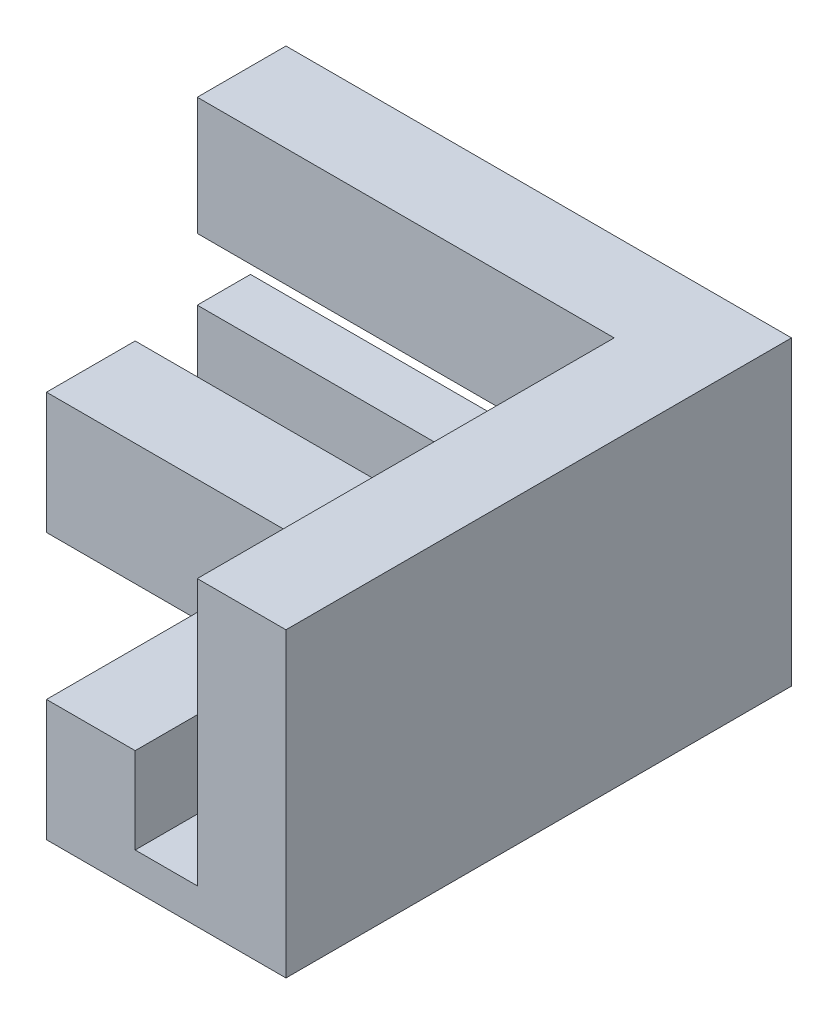
from build123d import *

# Parameters (mm, degrees)
BOSS_EXTRUDE1_DEPTH     = 15
BOSS_EXTRUDE2_DEPTH     = 2
CUT_EXTRUDE1_DEPTH      = 10.15
CUT_EXTRUDE2_DEPTH      = 4.85
CUT_EXTRUDE5_DEPTH      = 37.462309307
CUT_EXTRUDE5_DEPTH_BACK = 37.462309307
CHAMFER3_SIZE           = 2


with BuildPart() as part:
    # Sketch1 → Boss-Extrude1 (new body)
    with BuildSketch(Plane(origin=(0, 0, 0), x_dir=(1, 0, 0), z_dir=(0, 1, 0))):
        Polygon((23.5, 9.391735838), (-5, 9.391735838), (-5, -4.108264162), (10, -4.108264162), (10, -19.108264162), (23.5, -19.108264162), align=None)
        Polygon((0, 4.391735838), (0, 0.891735838), (15, 0.891735838), (15, -14.108264162), (18.5, -14.108264162), (18.5, 4.391735838), align=None, mode=Mode.SUBTRACT)
    extrude(amount=BOSS_EXTRUDE1_DEPTH)

    # Sketch2 → Boss-Extrude2 (add)
    with BuildSketch(Plane.XZ):
        Polygon((-5, 4.108264162), (10, 4.108264162), (10, 19.108264162), (23.5, 19.108264162), (23.5, -9.391735838), (-5, -9.391735838), align=None)
    extrude(amount=BOSS_EXTRUDE2_DEPTH)

    # Sketch3 → Cut-Extrude1 (cut)
    with BuildSketch(Plane(origin=(0, 15, 0), x_dir=(1, 0, 0), z_dir=(0, 1, 0))):
        Polygon((18.5, 4.391735838), (-5, 4.391735838), (-5, 0.891735838), (-5, -4.108264162), (10, -4.108264162), (10, -19.108264162), (15, -19.108264162), (18.5, -19.108264162), align=None)
    extrude(amount=-CUT_EXTRUDE1_DEPTH, mode=Mode.SUBTRACT)

    # Sketch4 → Cut-Extrude2 (cut)
    with BuildSketch(Plane(origin=(0, 4.85, 0), x_dir=(1, 0, 0), z_dir=(0, 1, 0))):
        Polygon((-5, 4.391735838), (18.5, 4.391735838), (18.5, -19.108264162), (15, -19.108264162), (15, 0.891735838), (-5, 0.891735838), align=None)
    extrude(amount=-CUT_EXTRUDE2_DEPTH, mode=Mode.SUBTRACT)

    # Sketch5 → Cut-Extrude5 (cut, two sides: drawn at the far end of the back side and taken through both)
    with BuildSketch(Plane.XY.offset(-4.391735838).offset(-CUT_EXTRUDE5_DEPTH_BACK)):
        Polygon((-5, 4.85), (18.5, 4.85), (18.5, 8.35), (-10.741212184, 8.35), (-10.741212184, 4.85), align=None)
    extrude(amount=CUT_EXTRUDE5_DEPTH + CUT_EXTRUDE5_DEPTH_BACK, mode=Mode.SUBTRACT)

    # Chamfer3
    chamfer3_edges = [part.edges().sort_by_distance(p)[0] for p in [
        (6.75, 8.35, -9.391735838),
        (6.75, 4.85, -9.391735838),
    ]]
    chamfer(chamfer3_edges, length=CHAMFER3_SIZE)


solid = part.part
